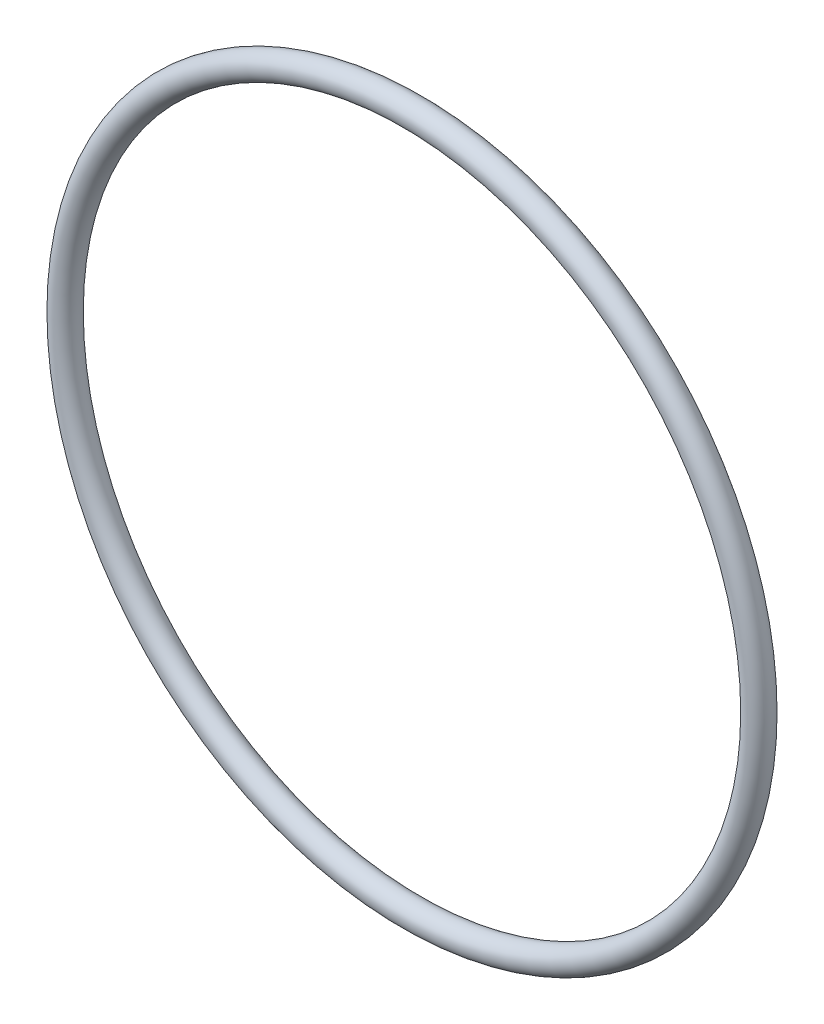
from build123d import *

# Parameters (mm, degrees)
SKETCH1_R = 1.3081


with BuildPart() as part:
    # Sketch1 → Revolve1 (revolve)
    with BuildSketch(Plane(origin=(0, 0, 0), x_dir=(0, -1, 0), z_dir=(1, 0, 0)), mode=Mode.PRIVATE) as revolve1_sk:
        with Locations((35.2806, 0)):
            Circle(SKETCH1_R)
    revolve(revolve1_sk.sketch.rotate(Axis((0, 0, 1.3081), (0, 0, -1)), 270), axis=Axis((0, 0, 1.3081), (0, 0, -1)))


solid = part.part
